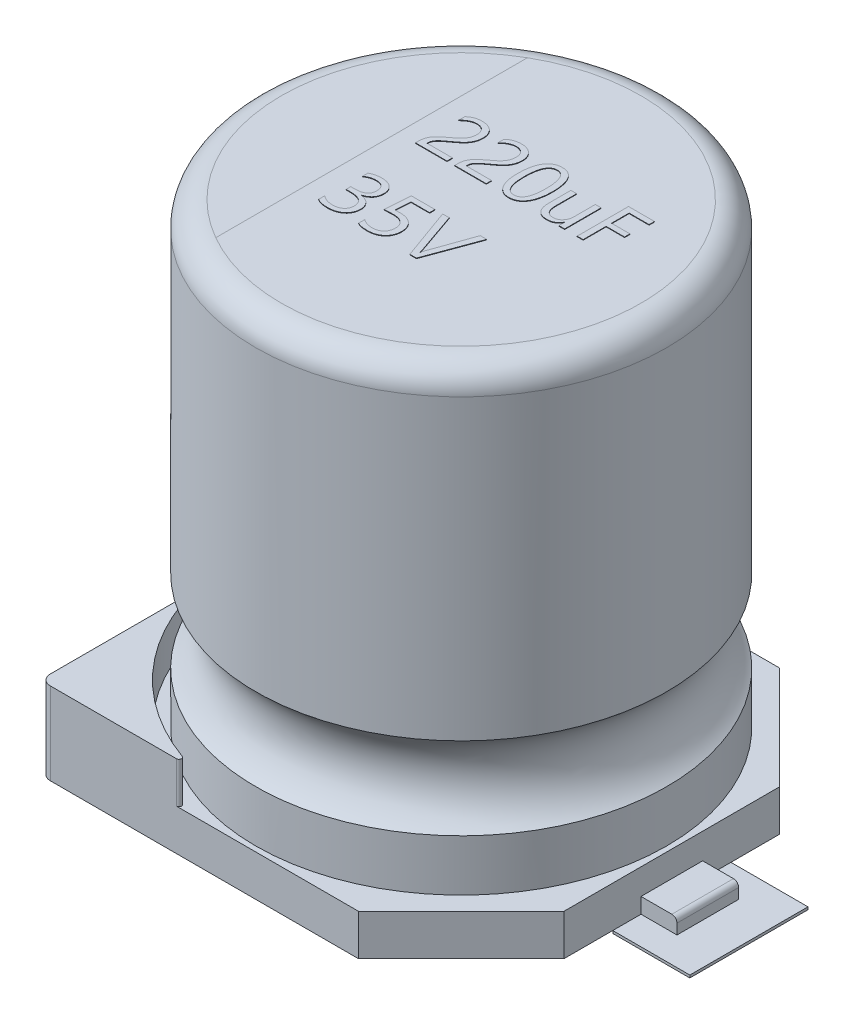
from build123d import *

# Parameters (mm, degrees)
SKETCH1_R             = 4
BOSS_EXTRUDE1_DEPTH   = 8.9
FILLET1_R             = 0.5
SKETCH3_W             = 8.2
SKETCH3_H             = 8.2
BOSS_EXTRUDE2_DEPTH   = 0.8
CHAMFER1_SIZE         = 2
BOSS_EXTRUDE3_DEPTH   = 0.8
FILLET2_R             = 0.05
SKETCH5_W             = 1.2
SKETCH5_H             = 0.3
BOSS_EXTRUDE4_DEPTH   = 0.7
FILLET3_R             = 0.1
FILLET4_R             = 0.2
BOSS_EXTRUDE5_DEPTH   = 0.01
SKETCH8_W             = 1.5
SKETCH8_H             = 2.3
BOSS_EXTRUDE6_DEPTH   = 0.05
BOSS_EXTRUDE6_2_DEPTH = 0.05


with BuildPart() as part:
    # Sketch1 → Boss-Extrude1 (new body)
    with BuildSketch(Plane(origin=(0, 0, 0), x_dir=(1, 0, 0), z_dir=(0, 1, 0))):
        with Locations(Location((0, 0, 0), (0, 0, 270))):
            Circle(SKETCH1_R)
    extrude(amount=BOSS_EXTRUDE1_DEPTH)

    # Sketch2 → Cut-Revolve1 (revolve, cut)
    with BuildSketch(Plane.XY, mode=Mode.PRIVATE) as cut_revolve1_sk:
        with BuildLine():
            Line((-4, 2.6), (-4, 1))
            ThreePointArc((-4, 1), (-3.6, 1.8), (-4, 2.6))
        make_face()
    revolve(cut_revolve1_sk.sketch.rotate(Axis((0, 0, 0), (0, 1, 0)), 270), axis=Axis((0, 0, 0), (0, 1, 0)), mode=Mode.SUBTRACT)

    # Fillet1
    fillet1_edges = [part.edges().sort_by_distance(p)[0] for p in [
        (0, 8.9, -4),
    ]]
    fillet(fillet1_edges, radius=FILLET1_R)

    # Sketch7 → Boss-Extrude5 (add)
    # profile 1 of 8: a face of its own
    with BuildSketch(Plane(origin=(0, 8.9, 0), x_dir=(1, 0, 0), z_dir=(0, 1, 0))):
        with BuildLine():
            add(Edge.make_bspline(
                [(-0.930125802, 1.236413932), (-0.930259114, 1.243960657), (-0.93051816, 1.258625219), (-0.933217585, 1.279837795), (-0.937690446, 1.299566075), (-0.94413612, 1.317704314), (-0.951973463, 1.334404835), (-0.960965693, 1.349697986), (-0.971418987, 1.363460373), (-0.983054115, 1.375758821), (-0.996025952, 1.386549119), (-1.009932817, 1.396056003), (-1.025099003, 1.403860125), (-1.041211775, 1.410259329), (-1.058234602, 1.415152609), (-1.075995938, 1.418551202), (-1.094393633, 1.421022673), (-1.106926382, 1.42116749), (-1.113308368, 1.421241235)],
                knots=[0, 0, 0, 0, 1.229976224, 2.390051507, 3.479695195, 4.522256188, 5.522020781, 6.484042306, 7.409278233, 8.334041706, 9.238256106, 10.155631384, 11.07524972, 12.01315198, 12.978606878, 13.958184871, 14.960257312, 16, 16, 16, 16], degree=3))
            add(Edge.make_bspline(
                [(-1.113308368, 1.421241235), (-1.124306368, 1.420793323), (-1.146359305, 1.419895181), (-1.178872583, 1.413005858), (-1.210521013, 1.40241095), (-1.241171261, 1.388330314), (-1.270914684, 1.371112065), (-1.299540216, 1.351126167), (-1.326558952, 1.328232214), (-1.343084419, 1.311316023), (-1.351384026, 1.302820182)],
                knots=[0, 0, 0, 0, 0.965628522, 1.936256016, 2.907294264, 3.893428475, 4.89415936, 5.923092914, 6.956912204, 8, 8, 8, 8], degree=3))
            Line((-1.351384026, 1.302820182), (-1.351384026, 1.42083005))
            add(Edge.make_bspline(
                [(-1.351384026, 1.42083005), (-1.343296156, 1.428056334), (-1.327247541, 1.442395319), (-1.300949265, 1.460807107), (-1.273441566, 1.476863251), (-1.244116711, 1.490122212), (-1.212383716, 1.500911096), (-1.177569131, 1.507976142), (-1.139616176, 1.512689044), (-1.11325576, 1.513121421), (-1.099533697, 1.513346498)],
                knots=[0, 0, 0, 0, 0.944214214, 1.873587351, 2.791167331, 3.715694743, 4.672957526, 5.704638579, 6.805136737, 8, 8, 8, 8], degree=3))
            add(Edge.make_bspline(
                [(-1.099533697, 1.513346498), (-1.089518573, 1.513173106), (-1.069843055, 1.512832463), (-1.040894307, 1.509428442), (-1.013088783, 1.50395329), (-0.986554824, 1.496101614), (-0.961388457, 1.486300469), (-0.937913947, 1.474271219), (-0.915882319, 1.460578007), (-0.895977467, 1.444386562), (-0.877700025, 1.426484826), (-0.861591307, 1.406379899), (-0.847568662, 1.384232224), (-0.835639917, 1.360212472), (-0.826140454, 1.334227892), (-0.819073757, 1.306500097), (-0.815276422, 1.276814851), (-0.814682385, 1.256503336), (-0.814377447, 1.246076761)],
                knots=[0, 0, 0, 0, 1.090983638, 2.143325233, 3.171486627, 4.175802002, 5.154894058, 6.110112073, 7.046608623, 7.976171165, 8.900318033, 9.829880575, 10.776682924, 11.751922351, 12.746640181, 13.786318399, 14.863643788, 16, 16, 16, 16], degree=3))
            add(Edge.make_bspline(
                [(-0.814377447, 1.246076761), (-0.814531458, 1.236477477), (-0.814832315, 1.217725566), (-0.817296719, 1.190235014), (-0.821581293, 1.1641952), (-0.827589826, 1.139459526), (-0.835290949, 1.115847829), (-0.84452299, 1.092916153), (-0.85568986, 1.07066016), (-0.86861869, 1.04908191), (-0.883474866, 1.028235552), (-0.899578239, 1.007520928), (-0.918102774, 0.987695275), (-0.938046494, 0.967928986), (-0.95974411, 0.948246214), (-0.983540843, 0.928904371), (-1.008684502, 0.908805781), (-1.026491879, 0.895947355), (-1.035594552, 0.889374458)],
                knots=[0, 0, 0, 0, 1.04820289, 2.047632774, 3.011021103, 3.927694667, 4.824695696, 5.721103316, 6.624792092, 7.54122121, 8.465198091, 9.418974354, 10.404208392, 11.42559055, 12.48532564, 13.601687869, 14.7740444, 16, 16, 16, 16], degree=3))
            add(Edge.make_bspline(
                [(-1.035594552, 0.889374458), (-1.0467608, 0.881350886), (-1.068090672, 0.866024183), (-1.098747881, 0.844129319), (-1.125870649, 0.823476711), (-1.150532456, 0.804966697), (-1.172179314, 0.787392622), (-1.191598763, 0.770750028), (-1.208272601, 0.754276876), (-1.22317442, 0.738674783), (-1.235595167, 0.723065216), (-1.246188175, 0.70768586), (-1.254710812, 0.692205633), (-1.261205012, 0.676468123), (-1.265985539, 0.660195794), (-1.26919072, 0.642970859), (-1.271348594, 0.624626665), (-1.271523986, 0.611968811), (-1.271614289, 0.605451761)],
                knots=[0, 0, 0, 0, 1.708614713, 3.263812021, 4.68081799, 5.944582465, 7.094984069, 8.145209792, 9.120763434, 10.006432465, 10.824334392, 11.596681272, 12.324558074, 13.015639001, 13.708135059, 14.427947188, 15.190609529, 16, 16, 16, 16], degree=3))
            Line((-1.271614289, 0.605451761), (-0.776137315, 0.605451761))
            Line((-0.776137315, 0.605451761), (-0.776137315, 0.500188603))
            Line((-0.776137315, 0.500188603), (-1.390240934, 0.500188603))
            Line((-1.390240934, 0.500188603), (-1.390240934, 0.549530708))
            add(Edge.make_bspline(
                [(-1.390240934, 0.549530708), (-1.390112493, 0.559885514), (-1.389862806, 0.580015245), (-1.387089622, 0.609264891), (-1.382867614, 0.636617894), (-1.376895913, 0.662301406), (-1.368836385, 0.68672351), (-1.358190542, 0.710143676), (-1.345652347, 0.73310337), (-1.330653103, 0.755473675), (-1.31330216, 0.777442221), (-1.293576524, 0.799395571), (-1.271447887, 0.821266274), (-1.246596291, 0.843251792), (-1.219042309, 0.865837507), (-1.188798854, 0.889960508), (-1.15557999, 0.915331717), (-1.132316114, 0.932513516), (-1.1202985, 0.941389261)],
                knots=[0, 0, 0, 0, 0.993935718, 1.932209879, 2.81819806, 3.64973488, 4.461244427, 5.283013065, 6.11642225, 6.970511397, 7.865615548, 8.802227002, 9.802589001, 10.85121407, 11.986896714, 13.223140369, 14.565534561, 16, 16, 16, 16], degree=3))
            add(Edge.make_bspline(
                [(-1.1202985, 0.941389261), (-1.111641587, 0.947800515), (-1.094865557, 0.960224736), (-1.070876025, 0.978759101), (-1.049583208, 0.997425348), (-1.030060537, 1.015265375), (-1.012617763, 1.033103702), (-0.99707653, 1.050910344), (-0.983161212, 1.068610325), (-0.967478787, 1.091941675), (-0.951391267, 1.121372266), (-0.938714616, 1.1585384), (-0.931274338, 1.196908293), (-0.930513309, 1.223085047), (-0.930125802, 1.236413932)],
                knots=[0, 0, 0, 0, 1.05745301, 2.049213797, 2.974384311, 3.835963594, 4.644633175, 5.421714405, 6.155056683, 6.852828246, 8.179982614, 9.432988448, 10.692908862, 12, 12, 12, 12], degree=3))
        make_face()
    # profile 2 of 8: a face of its own
    with BuildSketch(Plane(origin=(0, 8.9, 0), x_dir=(1, 0, 0), z_dir=(0, 1, 0))):
        with BuildLine():
            add(Edge.make_bspline(
                [(-0.166967907, 1.236413932), (-0.167101219, 1.243960657), (-0.167360266, 1.258625219), (-0.17005969, 1.279837795), (-0.174532551, 1.299566075), (-0.180978225, 1.317704314), (-0.188815569, 1.334404835), (-0.197807799, 1.349697986), (-0.208261093, 1.363460373), (-0.21989622, 1.375758821), (-0.232868057, 1.386549119), (-0.246774922, 1.396056003), (-0.261941108, 1.403860125), (-0.27805388, 1.410259329), (-0.295076707, 1.415152609), (-0.312838044, 1.418551202), (-0.331235738, 1.421022673), (-0.343768488, 1.42116749), (-0.350150473, 1.421241235)],
                knots=[0, 0, 0, 0, 1.229976224, 2.390051507, 3.479695195, 4.522256188, 5.522020781, 6.484042306, 7.409278233, 8.334041706, 9.238256106, 10.155631384, 11.07524972, 12.01315198, 12.978606878, 13.958184871, 14.960257312, 16, 16, 16, 16], degree=3))
            add(Edge.make_bspline(
                [(-0.350150473, 1.421241235), (-0.361148474, 1.420793323), (-0.38320141, 1.419895181), (-0.415714688, 1.413005858), (-0.447363119, 1.40241095), (-0.478013367, 1.388330314), (-0.507756789, 1.371112065), (-0.536382322, 1.351126167), (-0.563401057, 1.328232214), (-0.579926524, 1.311316023), (-0.588226131, 1.302820182)],
                knots=[0, 0, 0, 0, 0.965628522, 1.936256016, 2.907294264, 3.893428475, 4.89415936, 5.923092914, 6.956912204, 8, 8, 8, 8], degree=3))
            Line((-0.588226131, 1.302820182), (-0.588226131, 1.42083005))
            add(Edge.make_bspline(
                [(-0.588226131, 1.42083005), (-0.580138261, 1.428056334), (-0.564089646, 1.442395319), (-0.53779137, 1.460807107), (-0.510283672, 1.476863251), (-0.480958816, 1.490122212), (-0.449225821, 1.500911096), (-0.414411236, 1.507976142), (-0.376458281, 1.512689044), (-0.350097865, 1.513121421), (-0.336375802, 1.513346498)],
                knots=[0, 0, 0, 0, 0.944214214, 1.873587351, 2.791167331, 3.715694743, 4.672957526, 5.704638579, 6.805136737, 8, 8, 8, 8], degree=3))
            add(Edge.make_bspline(
                [(-0.336375802, 1.513346498), (-0.326360678, 1.513173106), (-0.30668516, 1.512832463), (-0.277736412, 1.509428442), (-0.249930889, 1.50395329), (-0.223396929, 1.496101614), (-0.198230563, 1.486300469), (-0.174756053, 1.474271219), (-0.152724424, 1.460578007), (-0.132819572, 1.444386562), (-0.11454213, 1.426484826), (-0.098433412, 1.406379899), (-0.084410767, 1.384232224), (-0.072482022, 1.360212472), (-0.062982559, 1.334227892), (-0.055915862, 1.306500097), (-0.052118527, 1.276814851), (-0.051524491, 1.256503336), (-0.051219552, 1.246076761)],
                knots=[0, 0, 0, 0, 1.090983638, 2.143325233, 3.171486627, 4.175802002, 5.154894058, 6.110112073, 7.046608623, 7.976171165, 8.900318033, 9.829880575, 10.776682924, 11.751922351, 12.746640181, 13.786318399, 14.863643788, 16, 16, 16, 16], degree=3))
            add(Edge.make_bspline(
                [(-0.051219552, 1.246076761), (-0.051373564, 1.236477477), (-0.05167442, 1.217725566), (-0.054138825, 1.190235014), (-0.058423399, 1.1641952), (-0.064431931, 1.139459526), (-0.072133054, 1.115847829), (-0.081365096, 1.092916153), (-0.092531965, 1.07066016), (-0.105460795, 1.04908191), (-0.120316971, 1.028235552), (-0.136420344, 1.007520928), (-0.154944879, 0.987695275), (-0.1748886, 0.967928986), (-0.196586215, 0.948246214), (-0.220382949, 0.928904371), (-0.245526608, 0.908805781), (-0.263333984, 0.895947355), (-0.272436657, 0.889374458)],
                knots=[0, 0, 0, 0, 1.04820289, 2.047632774, 3.011021103, 3.927694667, 4.824695696, 5.721103316, 6.624792092, 7.54122121, 8.465198091, 9.418974354, 10.404208392, 11.42559055, 12.48532564, 13.601687869, 14.7740444, 16, 16, 16, 16], degree=3))
            add(Edge.make_bspline(
                [(-0.272436657, 0.889374458), (-0.283602905, 0.881350886), (-0.304932777, 0.866024183), (-0.335589986, 0.844129319), (-0.362712754, 0.823476711), (-0.387374561, 0.804966697), (-0.409021419, 0.787392622), (-0.428440868, 0.770750028), (-0.445114706, 0.754276876), (-0.460016525, 0.738674783), (-0.472437273, 0.723065216), (-0.48303028, 0.70768586), (-0.491552917, 0.692205633), (-0.498047118, 0.676468123), (-0.502827644, 0.660195794), (-0.506032825, 0.642970859), (-0.508190699, 0.624626665), (-0.508366091, 0.611968811), (-0.508456394, 0.605451761)],
                knots=[0, 0, 0, 0, 1.708614713, 3.263812021, 4.68081799, 5.944582465, 7.094984069, 8.145209792, 9.120763434, 10.006432465, 10.824334392, 11.596681272, 12.324558074, 13.015639001, 13.708135059, 14.427947188, 15.190609529, 16, 16, 16, 16], degree=3))
            Line((-0.508456394, 0.605451761), (-0.012979421, 0.605451761))
            Line((-0.012979421, 0.605451761), (-0.012979421, 0.500188603))
            Line((-0.012979421, 0.500188603), (-0.627083039, 0.500188603))
            Line((-0.627083039, 0.500188603), (-0.627083039, 0.549530708))
            add(Edge.make_bspline(
                [(-0.627083039, 0.549530708), (-0.626954599, 0.559885514), (-0.626704911, 0.580015245), (-0.623931727, 0.609264891), (-0.619709719, 0.636617894), (-0.613738018, 0.662301406), (-0.60567849, 0.68672351), (-0.595032648, 0.710143676), (-0.582494452, 0.73310337), (-0.567495209, 0.755473675), (-0.550144265, 0.777442221), (-0.530418629, 0.799395571), (-0.508289992, 0.821266274), (-0.483438396, 0.843251792), (-0.455884415, 0.865837507), (-0.425640959, 0.889960508), (-0.392422095, 0.915331717), (-0.369158219, 0.932513516), (-0.357140605, 0.941389261)],
                knots=[0, 0, 0, 0, 0.993935718, 1.932209879, 2.81819806, 3.64973488, 4.461244427, 5.283013065, 6.11642225, 6.970511397, 7.865615548, 8.802227002, 9.802589001, 10.85121407, 11.986896714, 13.223140369, 14.565534561, 16, 16, 16, 16], degree=3))
            add(Edge.make_bspline(
                [(-0.357140605, 0.941389261), (-0.348483693, 0.947800515), (-0.331707662, 0.960224736), (-0.30771813, 0.978759101), (-0.286425314, 0.997425348), (-0.266902643, 1.015265375), (-0.249459869, 1.033103702), (-0.233918636, 1.050910344), (-0.220003318, 1.068610325), (-0.204320892, 1.091941675), (-0.188233373, 1.121372266), (-0.175556721, 1.1585384), (-0.168116443, 1.196908293), (-0.167355414, 1.223085047), (-0.166967907, 1.236413932)],
                knots=[0, 0, 0, 0, 1.05745301, 2.049213797, 2.974384311, 3.835963594, 4.644633175, 5.421714405, 6.155056683, 6.852828246, 8.179982614, 9.432988448, 10.692908862, 12, 12, 12, 12], degree=3))
        make_face()
    # profile 3 of 8: a face of its own
    with BuildSketch(Plane(origin=(0, 8.9, 0), x_dir=(1, 0, 0), z_dir=(0, 1, 0))):
        with BuildLine():
            add(Edge.make_bspline(
                [(0.768270579, 1.004711629), (0.767984026, 0.984557566), (0.767426863, 0.945370772), (0.763418175, 0.888304877), (0.756186625, 0.834774088), (0.746455105, 0.78474756), (0.733960132, 0.738431643), (0.718972384, 0.695758481), (0.701389132, 0.65682236), (0.681174329, 0.621736309), (0.658846167, 0.590281443), (0.633450707, 0.563262978), (0.606078237, 0.539685765), (0.575992083, 0.520517467), (0.54373231, 0.505217818), (0.50901846, 0.495007822), (0.472430214, 0.488007663), (0.447238608, 0.487360705), (0.434389, 0.487030708)],
                knots=[0, 0, 0, 0, 1.398980466, 2.720124312, 3.96812368, 5.146432578, 6.255415985, 7.295087503, 8.282879546, 9.216336252, 10.102253837, 10.953825877, 11.784043498, 12.603506409, 13.42284504, 14.253498671, 15.109153359, 16, 16, 16, 16], degree=3))
            add(Edge.make_bspline(
                [(0.434389, 0.487030708), (0.422230969, 0.487403858), (0.398436735, 0.488134142), (0.363754287, 0.494513325), (0.331026039, 0.504747043), (0.300408199, 0.519260787), (0.271987746, 0.537718507), (0.246029721, 0.560078852), (0.222359986, 0.586154425), (0.200953607, 0.615858168), (0.182100935, 0.649361911), (0.165598018, 0.686395783), (0.151799052, 0.727057537), (0.140003843, 0.771117384), (0.131133053, 0.818768253), (0.124605791, 0.869693802), (0.120647388, 0.923988105), (0.120245611, 0.961256343), (0.120038671, 0.980451761)],
                knots=[0, 0, 0, 0, 0.888155269, 1.738190458, 2.568434008, 3.38864091, 4.207101744, 5.03849325, 5.886044594, 6.7759361, 7.709272942, 8.69152049, 9.735599895, 10.845083744, 12.023162705, 13.27590253, 14.596923554, 16, 16, 16, 16], degree=3))
            add(Edge.make_bspline(
                [(0.120038671, 0.980451761), (0.120314337, 1.001497645), (0.120850059, 1.042397677), (0.124995631, 1.101825233), (0.131680111, 1.157428823), (0.141006661, 1.20925434), (0.153313788, 1.257126333), (0.168031411, 1.301093022), (0.18526661, 1.341086758), (0.205206931, 1.376997022), (0.227640682, 1.40900922), (0.252881939, 1.436746934), (0.280558491, 1.460461121), (0.31096194, 1.479788402), (0.343763603, 1.49483533), (0.37896513, 1.505504416), (0.416305751, 1.512337738), (0.442033999, 1.513005818), (0.455153803, 1.513346498)],
                knots=[0, 0, 0, 0, 1.426258677, 2.771754592, 4.035124818, 5.220331935, 6.337825632, 7.382114204, 8.359741748, 9.284994213, 10.161296122, 11.002979272, 11.820109764, 12.624106341, 13.436709906, 14.257961594, 15.111668944, 16, 16, 16, 16], degree=3))
            add(Edge.make_bspline(
                [(0.455153803, 1.513346498), (0.467789027, 1.512959369), (0.492452111, 1.512203721), (0.528206054, 1.506094994), (0.561617433, 1.496387059), (0.592397229, 1.482139609), (0.620789145, 1.464156343), (0.646779028, 1.442121729), (0.669979565, 1.415950319), (0.691035204, 1.3860259), (0.709055435, 1.351883719), (0.725299825, 1.31408476), (0.738401979, 1.272056949), (0.749543511, 1.226276634), (0.757771097, 1.176431001), (0.763905061, 1.12277945), (0.767619878, 1.065070853), (0.768048881, 1.025276442), (0.768270579, 1.004711629)],
                knots=[0, 0, 0, 0, 0.899241396, 1.755257189, 2.575108327, 3.369931066, 4.161902333, 4.96169813, 5.78762661, 6.645962214, 7.56082504, 8.531597655, 9.571777694, 10.691464586, 11.88443752, 13.166498411, 14.535713275, 16, 16, 16, 16], degree=3))
        make_face()
        with BuildLine():
            add(Edge.make_bspline(
                [(0.651699856, 0.993198471), (0.651522889, 1.010469562), (0.651180034, 1.043930687), (0.649093063, 1.092507874), (0.644804237, 1.137667761), (0.639767405, 1.179587018), (0.632455014, 1.218050581), (0.624029426, 1.253280964), (0.613704359, 1.285169971), (0.601960849, 1.313719893), (0.588489921, 1.338955551), (0.573519063, 1.360931968), (0.556847658, 1.379614653), (0.538509059, 1.394887973), (0.518583963, 1.406866101), (0.496880754, 1.414960968), (0.473790601, 1.420441518), (0.457791004, 1.42097051), (0.449602816, 1.421241235)],
                knots=[0, 0, 0, 0, 1.581181307, 3.063391078, 4.449305256, 5.73327765, 6.92683892, 8.031533681, 9.047337031, 9.992258722, 10.853979057, 11.661441156, 12.421081853, 13.138403699, 13.838846326, 14.537910874, 15.251739941, 16, 16, 16, 16], degree=3))
            add(Edge.make_bspline(
                [(0.449602816, 1.421241235), (0.441008756, 1.420956637), (0.424138756, 1.420397978), (0.39975072, 1.415083426), (0.376953282, 1.406638965), (0.35592608, 1.394518687), (0.336701034, 1.378867186), (0.319054913, 1.359920592), (0.303263696, 1.337502337), (0.289112272, 1.311820005), (0.276458182, 1.28281579), (0.26607136, 1.250213365), (0.256697728, 1.214429829), (0.249535481, 1.175157744), (0.243480639, 1.132653105), (0.239548982, 1.086666414), (0.23703384, 1.037292279), (0.236754015, 1.003207366), (0.236609395, 0.985591563)],
                knots=[0, 0, 0, 0, 0.764995805, 1.501674303, 2.212925961, 2.924256282, 3.65393935, 4.414460527, 5.224546987, 6.091227052, 7.023912083, 8.039810551, 9.137474513, 10.318540051, 11.595133009, 12.962565651, 14.430189818, 16, 16, 16, 16], degree=3))
            add(Edge.make_bspline(
                [(0.236609395, 0.985591563), (0.236755854, 0.969209241), (0.237039756, 0.937452912), (0.239543531, 0.891364271), (0.243523341, 0.848405362), (0.249348493, 0.808633363), (0.256283216, 0.771954437), (0.265416837, 0.738621381), (0.275777484, 0.708264032), (0.288118237, 0.681192385), (0.301765507, 0.656982181), (0.317577808, 0.636351776), (0.334643822, 0.618478865), (0.35379437, 0.604260881), (0.374382427, 0.592951387), (0.396618963, 0.58487104), (0.420546736, 0.580072872), (0.437039497, 0.579453407), (0.445490974, 0.579135971)],
                knots=[0, 0, 0, 0, 1.543513286, 2.992024866, 4.347767877, 5.607075833, 6.778486024, 7.862468221, 8.861099137, 9.797386861, 10.662401359, 11.473455982, 12.240599663, 12.983190345, 13.711379138, 14.446775782, 15.204072658, 16, 16, 16, 16], degree=3))
            add(Edge.make_bspline(
                [(0.445490974, 0.579135971), (0.453803181, 0.579462603), (0.470087117, 0.580102486), (0.493797116, 0.584815964), (0.515775862, 0.593201099), (0.536230147, 0.604593384), (0.554849281, 0.619420262), (0.571839842, 0.637397511), (0.587421335, 0.658496883), (0.600698358, 0.683184252), (0.61303245, 0.710733256), (0.623309355, 0.741627939), (0.632165265, 0.77569519), (0.639188306, 0.813015594), (0.645031646, 0.85347046), (0.648698582, 0.897202574), (0.651291767, 0.944099177), (0.651560842, 0.976472965), (0.651699856, 0.993198471)],
                knots=[0, 0, 0, 0, 0.775360401, 1.518961016, 2.243373551, 2.96192122, 3.694889719, 4.454670758, 5.264184671, 6.134259122, 7.064577354, 8.077594077, 9.167837551, 10.346585987, 11.618858978, 12.979815247, 14.439659868, 16, 16, 16, 16], degree=3))
        make_face(mode=Mode.SUBTRACT)
    # profile 4 of 8: a face of its own
    with BuildSketch(Plane(origin=(0, 8.9, 0), x_dir=(1, 0, 0), z_dir=(0, 1, 0))):
        with BuildLine():
            Line((1.513336369, 0.500188603), (1.399438343, 0.500188603))
            Line((1.399438343, 0.500188603), (1.399438343, 0.612441892))
            Line((1.399438343, 0.612441892), (1.396765645, 0.612441892))
            add(Edge.make_bspline(
                [(1.396765645, 0.612441892), (1.390720663, 0.602460299), (1.378922171, 0.5829784), (1.357224617, 0.557406109), (1.333497285, 0.535340747), (1.30679844, 0.517874984), (1.27796377, 0.503876254), (1.246605155, 0.493991312), (1.212766798, 0.488233325), (1.189414343, 0.487439271), (1.177398869, 0.487030708)],
                knots=[0, 0, 0, 0, 1.050691007, 2.050720406, 3.012962404, 3.962401766, 4.915874185, 5.894932476, 6.916885468, 8, 8, 8, 8], degree=3))
            add(Edge.make_bspline(
                [(1.177398869, 0.487030708), (1.167106673, 0.487257871), (1.147213655, 0.487696936), (1.11834269, 0.491353296), (1.091359331, 0.496789144), (1.066537263, 0.505487129), (1.043447569, 0.515877394), (1.022427463, 0.528850187), (1.003437756, 0.544280218), (0.986572548, 0.56212546), (0.971356904, 0.582119485), (0.958722421, 0.604808693), (0.947754222, 0.629646774), (0.938794621, 0.656780083), (0.931760999, 0.68627913), (0.926955997, 0.718120739), (0.92409119, 0.75232886), (0.923696159, 0.775881872), (0.923492619, 0.78801755)],
                knots=[0, 0, 0, 0, 1.09540131, 2.117219514, 3.094696566, 4.020015321, 4.911365501, 5.786165053, 6.642013186, 7.509079247, 8.394916856, 9.30993597, 10.267157936, 11.282441873, 12.347880503, 13.49236844, 14.707944063, 16, 16, 16, 16], degree=3))
            Line((0.923492619, 0.78801755), (0.923492619, 1.210714919))
            Line((0.923492619, 1.210714919), (1.036568277, 1.210714919))
            Line((1.036568277, 1.210714919), (1.036568277, 0.804053735))
            add(Edge.make_bspline(
                [(1.036568277, 0.804053735), (1.036658129, 0.79500285), (1.03683264, 0.777424219), (1.038994686, 0.751898193), (1.042143232, 0.72804247), (1.046826816, 0.705955212), (1.053044542, 0.68569587), (1.060388214, 0.66715835), (1.068975395, 0.650310847), (1.079241694, 0.635355566), (1.090611126, 0.621958112), (1.103608072, 0.610479502), (1.117877537, 0.600820717), (1.133413594, 0.592673278), (1.150370126, 0.586537416), (1.168663857, 0.582288295), (1.188210634, 0.579518344), (1.201717402, 0.57926565), (1.208648869, 0.579135971)],
                knots=[0, 0, 0, 0, 1.343703186, 2.609740898, 3.801442941, 4.915248641, 5.95827345, 6.944754588, 7.873313373, 8.759642607, 9.632786239, 10.476245362, 11.325882859, 12.18618061, 13.074785555, 13.995503533, 14.971323121, 16, 16, 16, 16], degree=3))
            add(Edge.make_bspline(
                [(1.208648869, 0.579135971), (1.215444264, 0.579340895), (1.228822529, 0.579744332), (1.248382544, 0.582703586), (1.267049545, 0.587339775), (1.284654366, 0.594262065), (1.301392063, 0.602948489), (1.317350699, 0.613434023), (1.332147143, 0.626102121), (1.345940795, 0.640486012), (1.358314303, 0.656498858), (1.369603949, 0.673539607), (1.378805849, 0.692024015), (1.38648315, 0.711539654), (1.39212846, 0.732324927), (1.396555207, 0.754141181), (1.398974255, 0.77727204), (1.39928124, 0.793083669), (1.399438343, 0.801175445)],
                knots=[0, 0, 0, 0, 0.99348202, 1.955893163, 2.886897847, 3.800751478, 4.715209456, 5.640858053, 6.586634716, 7.557773505, 8.550193329, 9.542613152, 10.542143211, 11.563936364, 12.604722674, 13.687744657, 14.816677783, 16, 16, 16, 16], degree=3))
            Line((1.399438343, 0.801175445), (1.399438343, 1.210714919))
            Line((1.399438343, 1.210714919), (1.513336369, 1.210714919))
            Line((1.513336369, 1.210714919), (1.513336369, 0.500188603))
        make_face()
    # profile 5 of 8: a face of its own
    with BuildSketch(Plane(origin=(0, 8.9, 0), x_dir=(1, 0, 0), z_dir=(0, 1, 0))):
        Polygon((2.261897224, 1.394925445), (1.873328145, 1.394925445), (1.873328145, 1.052820182), (2.232703145, 1.052820182), (2.232703145, 0.947557024), (1.873328145, 0.947557024), (1.873328145, 0.500188603), (1.756757421, 0.500188603), (1.756757421, 1.500188603), (2.261897224, 1.500188603), align=None)
    # profile 6 of 8: a face of its own
    with BuildSketch(Plane(origin=(0, 8.9, 0), x_dir=(1, 0, 0), z_dir=(0, 1, 0))):
        with BuildLine():
            add(Edge.make_bspline(
                [(-0.804714618, -1.148129406), (-0.805031256, -1.159112704), (-0.8056537, -1.180703538), (-0.810545623, -1.212322365), (-0.81821854, -1.242521604), (-0.829485239, -1.270996221), (-0.843387288, -1.297682296), (-0.860079885, -1.322502116), (-0.879355425, -1.34528654), (-0.901348015, -1.36596671), (-0.925648549, -1.384414873), (-0.952206937, -1.40091553), (-0.981289155, -1.41466786), (-1.012355786, -1.426716232), (-1.04546405, -1.436091712), (-1.080316635, -1.442913456), (-1.116853492, -1.446775249), (-1.141739816, -1.447372584), (-1.154426789, -1.447677104)],
                knots=[0, 0, 0, 0, 1.019101285, 2.003336971, 2.96304981, 3.905745115, 4.839035233, 5.7512084, 6.676507669, 7.603532857, 8.547600853, 9.50446321, 10.500287074, 11.529287479, 12.594462435, 13.68984929, 14.822292144, 16, 16, 16, 16], degree=3))
            add(Edge.make_bspline(
                [(-1.154426789, -1.447677104), (-1.165944596, -1.447526788), (-1.188459435, -1.447232953), (-1.221336029, -1.444725511), (-1.25237966, -1.440705925), (-1.281633165, -1.434909093), (-1.309040274, -1.4275651), (-1.334761093, -1.418788037), (-1.35857901, -1.408099658), (-1.373314855, -1.399493208), (-1.380578105, -1.395251117)],
                knots=[0, 0, 0, 0, 1.175724286, 2.298288404, 3.363967618, 4.369719485, 5.340477689, 6.258710396, 7.141724009, 8, 8, 8, 8], degree=3))
            Line((-1.380578105, -1.395251117), (-1.380578105, -1.276624472))
            add(Edge.make_bspline(
                [(-1.380578105, -1.276624472), (-1.372113234, -1.282940122), (-1.355363809, -1.295436887), (-1.328682314, -1.311438333), (-1.301220419, -1.325144501), (-1.272730503, -1.336277689), (-1.24334211, -1.344879631), (-1.213092942, -1.351082153), (-1.181936645, -1.35488503), (-1.160810908, -1.355340909), (-1.150109355, -1.35557184)],
                knots=[0, 0, 0, 0, 1.020300071, 2.018866019, 3.00237846, 3.983992981, 4.971245873, 5.95856543, 6.965881301, 8, 8, 8, 8], degree=3))
            add(Edge.make_bspline(
                [(-1.150109355, -1.35557184), (-1.141675575, -1.355410944), (-1.12511342, -1.355094978), (-1.100885827, -1.352709018), (-1.07798391, -1.348242785), (-1.056277923, -1.342703383), (-1.036079887, -1.334907669), (-1.017141665, -1.326003007), (-0.999750075, -1.315404178), (-0.983836357, -1.303503071), (-0.969564045, -1.290051617), (-0.95698736, -1.275241922), (-0.94619398, -1.259007402), (-0.937164125, -1.241502035), (-0.929860842, -1.222799256), (-0.925060693, -1.202799784), (-0.921829579, -1.181814566), (-0.921469052, -1.167399238), (-0.921285342, -1.160053748)],
                knots=[0, 0, 0, 0, 1.193357867, 2.343501928, 3.438959172, 4.492721389, 5.508499269, 6.497400075, 7.450321688, 8.385111628, 9.304331213, 10.219398486, 11.128434492, 12.056561698, 13.002003861, 13.96156304, 14.961291981, 16, 16, 16, 16], degree=3))
            add(Edge.make_bspline(
                [(-0.921285342, -1.160053748), (-0.921452323, -1.152022907), (-0.921777803, -1.136369207), (-0.925179058, -1.1137093), (-0.930453269, -1.092500743), (-0.938055121, -1.072844694), (-0.948003418, -1.05483614), (-0.960076511, -1.038435383), (-0.974193271, -1.02348093), (-0.990538325, -1.010044392), (-1.009173514, -0.998365958), (-1.029907565, -0.988216965), (-1.052840822, -0.979913093), (-1.077856579, -0.972919607), (-1.105056449, -0.967378448), (-1.134461499, -0.963559604), (-1.165973689, -0.961326297), (-1.187660477, -0.961002062), (-1.198834684, -0.960834998)],
                knots=[0, 0, 0, 0, 0.990580855, 1.930838357, 2.821223158, 3.683604226, 4.524093985, 5.353097825, 6.190816286, 7.056179088, 7.957307443, 8.899275577, 9.900203706, 10.963355231, 12.103032959, 13.323269139, 14.620803362, 16, 16, 16, 16], degree=3))
            Line((-1.198834684, -0.960834998), (-1.281277118, -0.960834998))
            Line((-1.281277118, -0.960834998), (-1.281277118, -0.868729735))
            Line((-1.281277118, -0.868729735), (-1.202946526, -0.868729735))
            add(Edge.make_bspline(
                [(-1.202946526, -0.868729735), (-1.193007467, -0.868540155), (-1.173792977, -0.868173654), (-1.145891773, -0.866262661), (-1.119977347, -0.862427464), (-1.0958372, -0.857749578), (-1.073772669, -0.85100883), (-1.053424255, -0.843334983), (-1.035072614, -0.83388113), (-1.018743146, -0.8228767), (-1.004084717, -0.810708342), (-0.991571883, -0.796887751), (-0.980872113, -0.781651578), (-0.972281366, -0.764877929), (-0.965408434, -0.74669158), (-0.960818977, -0.727053228), (-0.957834636, -0.706060275), (-0.957458433, -0.691588816), (-0.95726396, -0.684108025)],
                knots=[0, 0, 0, 0, 1.361615543, 2.632316345, 3.827071242, 4.948204408, 5.996555552, 6.983205608, 7.923628678, 8.816616634, 9.675964955, 10.526501328, 11.362408219, 12.21888074, 13.10109775, 14.018614351, 14.97575406, 16, 16, 16, 16], degree=3))
            add(Edge.make_bspline(
                [(-0.95726396, -0.684108025), (-0.95745195, -0.677182738), (-0.95781575, -0.663780842), (-0.959752018, -0.644352256), (-0.963511473, -0.626333625), (-0.9686285, -0.609586717), (-0.975175194, -0.594110872), (-0.983215575, -0.580000661), (-0.992865472, -0.56726574), (-1.003850801, -0.555807254), (-1.016457943, -0.545758273), (-1.030517917, -0.537167528), (-1.045933022, -0.529751133), (-1.062837544, -0.523789767), (-1.081125224, -0.519049017), (-1.101022061, -0.515876849), (-1.122307578, -0.513739142), (-1.137014352, -0.513558989), (-1.144558368, -0.513466577)],
                knots=[0, 0, 0, 0, 1.144475627, 2.214802505, 3.220728203, 4.180545248, 5.103803117, 5.991379618, 6.856426605, 7.737261095, 8.607258638, 9.512214307, 10.4541674, 11.428302948, 12.469117141, 13.571076801, 14.754054657, 16, 16, 16, 16], degree=3))
            add(Edge.make_bspline(
                [(-1.144558368, -0.513466577), (-1.153271214, -0.513660574), (-1.170614533, -0.514046732), (-1.196460904, -0.517276541), (-1.221912992, -0.522346096), (-1.246927429, -0.529619694), (-1.271475426, -0.538890374), (-1.295607949, -0.550337615), (-1.319498714, -0.563554497), (-1.334674891, -0.573987828), (-1.342337973, -0.579256051)],
                knots=[0, 0, 0, 0, 0.986643374, 1.963958899, 2.945918741, 3.923727424, 4.911347552, 5.914946884, 6.94716999, 8, 8, 8, 8], degree=3))
            Line((-1.342337973, -0.579256051), (-1.342337973, -0.475020854))
            add(Edge.make_bspline(
                [(-1.342337973, -0.475020854), (-1.334313811, -0.470712742), (-1.318143628, -0.462031095), (-1.292571059, -0.451268954), (-1.265941961, -0.441958124), (-1.238204929, -0.434317891), (-1.209243276, -0.428689844), (-1.179280012, -0.424273374), (-1.148094441, -0.421830319), (-1.126949941, -0.421519521), (-1.116186657, -0.421361314)],
                knots=[0, 0, 0, 0, 0.92965156, 1.873421247, 2.829591002, 3.809240957, 4.808444756, 5.840751768, 6.9008678, 8, 8, 8, 8], degree=3))
            add(Edge.make_bspline(
                [(-1.116186657, -0.421361314), (-1.10603432, -0.421533555), (-1.086085178, -0.421872005), (-1.057011528, -0.425261363), (-1.029331999, -0.430533872), (-1.003303978, -0.438196717), (-0.97876251, -0.447568336), (-0.956081226, -0.458933787), (-0.935194447, -0.471902725), (-0.916167806, -0.486560316), (-0.899075553, -0.502817061), (-0.883904639, -0.52061409), (-0.87088699, -0.540078482), (-0.860026398, -0.561049279), (-0.851296722, -0.583352405), (-0.845195716, -0.606886134), (-0.841359328, -0.631556179), (-0.840918137, -0.648389153), (-0.840693236, -0.656969867)],
                knots=[0, 0, 0, 0, 1.197034325, 2.352148888, 3.447599133, 4.516879017, 5.548177483, 6.54231138, 7.50454852, 8.443935387, 9.370188229, 10.282043863, 11.19676135, 12.125937188, 13.062642227, 14.015530744, 14.988404392, 16, 16, 16, 16], degree=3))
            add(Edge.make_bspline(
                [(-0.840693236, -0.656969867), (-0.840866106, -0.664923951), (-0.841205106, -0.680522009), (-0.843418775, -0.70335583), (-0.847388687, -0.72505397), (-0.852678003, -0.745714975), (-0.859618195, -0.765301715), (-0.868439713, -0.783701759), (-0.87833428, -0.801172273), (-0.890109896, -0.817388144), (-0.903180705, -0.832662693), (-0.918140027, -0.846604611), (-0.934445761, -0.859678035), (-0.952398977, -0.871524776), (-0.971771396, -0.882526463), (-0.992784165, -0.892120699), (-1.01536155, -0.900565727), (-1.031043549, -0.905341763), (-1.039089618, -0.907792235)],
                knots=[0, 0, 0, 0, 1.096960776, 2.151153854, 3.159618439, 4.136134396, 5.089743263, 6.019833047, 6.947085499, 7.854572729, 8.77922067, 9.715197914, 10.670163965, 11.658363707, 12.678233686, 13.739646337, 14.840265149, 16, 16, 16, 16], degree=3))
            Line((-1.039089618, -0.907792235), (-1.039089618, -0.910670525))
            add(Edge.make_bspline(
                [(-1.039089618, -0.910670525), (-1.030783191, -0.911806902), (-1.014419407, -0.914045583), (-0.990398194, -0.919043225), (-0.967569, -0.926484516), (-0.945531067, -0.934924636), (-0.924858448, -0.945294604), (-0.905323232, -0.956753399), (-0.887435698, -0.969938123), (-0.871089828, -0.984644676), (-0.856302948, -1.000686878), (-0.842983429, -1.017995709), (-0.831734606, -1.036845889), (-0.822010133, -1.056826634), (-0.814139848, -1.077997543), (-0.808600806, -1.100404754), (-0.805236443, -1.123903377), (-0.804890523, -1.139962925), (-0.804714618, -1.148129406)],
                knots=[0, 0, 0, 0, 1.09354583, 2.154301538, 3.194710689, 4.222252129, 5.229688408, 6.207785533, 7.17326046, 8.12275326, 9.071656757, 10.015663309, 10.966165492, 11.929693435, 12.91109378, 13.906239898, 14.935296686, 16, 16, 16, 16], degree=3))
        make_face()
    # profile 7 of 8: a face of its own
    with BuildSketch(Plane(origin=(0, 8.9, 0), x_dir=(1, 0, 0), z_dir=(0, 1, 0))):
        with BuildLine():
            add(Edge.make_bspline(
                [(-0.03045475, -1.127775788), (-0.030802403, -1.139574748), (-0.031484148, -1.162712395), (-0.035906733, -1.196669956), (-0.04406565, -1.228776685), (-0.054874076, -1.259148157), (-0.068806492, -1.287475253), (-0.085215565, -1.313832799), (-0.104354349, -1.338196132), (-0.126176369, -1.360347166), (-0.150424426, -1.380386349), (-0.177374985, -1.397725884), (-0.206473587, -1.413005561), (-0.238108655, -1.425393112), (-0.271594661, -1.435646199), (-0.307107851, -1.44238049), (-0.344344432, -1.4469306), (-0.36980431, -1.447424321), (-0.382839618, -1.447677104)],
                knots=[0, 0, 0, 0, 1.056864167, 2.072500419, 3.059485391, 4.018613275, 4.954681828, 5.881162702, 6.794724112, 7.723560484, 8.661137091, 9.605998599, 10.588833302, 11.59982216, 12.644532083, 13.720683555, 14.833003331, 16, 16, 16, 16], degree=3))
            add(Edge.make_bspline(
                [(-0.382839618, -1.447677104), (-0.394011781, -1.44755688), (-0.415687047, -1.447323631), (-0.44705982, -1.445589255), (-0.476188121, -1.442162006), (-0.503154717, -1.438066715), (-0.52787873, -1.432285861), (-0.550359407, -1.425324282), (-0.570695721, -1.417259251), (-0.582942468, -1.410454138), (-0.588842907, -1.407175459)],
                knots=[0, 0, 0, 0, 1.263126396, 2.450608766, 3.550077914, 4.578015321, 5.532741343, 6.41739748, 7.237507678, 8, 8, 8, 8], degree=3))
            Line((-0.588842907, -1.407175459), (-0.588842907, -1.289782367))
            add(Edge.make_bspline(
                [(-0.588842907, -1.289782367), (-0.580486624, -1.295047632), (-0.563958074, -1.305462213), (-0.538240806, -1.318689721), (-0.512514242, -1.330073303), (-0.486640452, -1.339444348), (-0.46057513, -1.346605094), (-0.434330806, -1.351776104), (-0.407933099, -1.354979568), (-0.39024973, -1.355374304), (-0.381400473, -1.35557184)],
                knots=[0, 0, 0, 0, 1.073575538, 2.123509434, 3.141212585, 4.131255582, 5.1129617, 6.077547705, 7.037950563, 8, 8, 8, 8], degree=3))
            add(Edge.make_bspline(
                [(-0.381400473, -1.35557184), (-0.372617836, -1.355388981), (-0.355407639, -1.355030654), (-0.330324015, -1.351802344), (-0.306442828, -1.347029456), (-0.284039183, -1.339744061), (-0.263136581, -1.330749682), (-0.243776786, -1.320167604), (-0.22602342, -1.308039635), (-0.209871884, -1.29419492), (-0.19549013, -1.278678747), (-0.182606955, -1.261858724), (-0.171937685, -1.243311522), (-0.162893185, -1.223573267), (-0.155556814, -1.20255171), (-0.150878043, -1.180358364), (-0.147550102, -1.157275006), (-0.147202924, -1.141563111), (-0.147025473, -1.133532367)],
                knots=[0, 0, 0, 0, 1.158660806, 2.270477318, 3.333079092, 4.368579658, 5.373363954, 6.332745853, 7.27608927, 8.206156569, 9.134110276, 10.063957633, 10.99630925, 11.951503368, 12.926911662, 13.927616427, 14.940752784, 16, 16, 16, 16], degree=3))
            add(Edge.make_bspline(
                [(-0.147025473, -1.133532367), (-0.147214801, -1.125504516), (-0.147585215, -1.109798279), (-0.150720263, -1.086857782), (-0.15588238, -1.065263813), (-0.162741731, -1.044864207), (-0.172226903, -1.026114831), (-0.183233505, -1.008384945), (-0.196845966, -0.992409341), (-0.212000946, -0.977427808), (-0.229393724, -0.964366436), (-0.248489767, -0.952710772), (-0.269472669, -0.942803068), (-0.292445879, -0.9351487), (-0.317112227, -0.928920598), (-0.343575951, -0.924473626), (-0.371954044, -0.921743454), (-0.391468002, -0.921491479), (-0.4015485, -0.921361314)],
                knots=[0, 0, 0, 0, 1.024220939, 2.003855773, 2.947861307, 3.855091956, 4.742976808, 5.623725423, 6.511739495, 7.414744547, 8.338353125, 9.280330718, 10.266270024, 11.292393647, 12.365736532, 13.510265708, 14.713855882, 16, 16, 16, 16], degree=3))
            add(Edge.make_bspline(
                [(-0.4015485, -0.921361314), (-0.408402298, -0.921394443), (-0.422523667, -0.921462702), (-0.444035494, -0.922254008), (-0.466114501, -0.922665261), (-0.488237145, -0.923887785), (-0.510116155, -0.924724478), (-0.531286091, -0.926244892), (-0.551239012, -0.92779629), (-0.564037249, -0.929147098), (-0.570134026, -0.92979059)],
                knots=[0, 0, 0, 0, 0.974070636, 2.006947305, 3.059296761, 4.112367188, 5.155707916, 6.170982707, 7.128699404, 8, 8, 8, 8], degree=3))
            Line((-0.570134026, -0.92979059), (-0.536211329, -0.434519209))
            Line((-0.536211329, -0.434519209), (-0.076096197, -0.434519209))
            Line((-0.076096197, -0.434519209), (-0.076096197, -0.539782367))
            Line((-0.076096197, -0.539782367), (-0.43773271, -0.539782367))
            Line((-0.43773271, -0.539782367), (-0.457880736, -0.832751117))
            add(Edge.make_bspline(
                [(-0.457880736, -0.832751117), (-0.450275909, -0.832230981), (-0.434595457, -0.831158508), (-0.411007154, -0.830322134), (-0.388055393, -0.829335855), (-0.373177766, -0.829281563), (-0.366186657, -0.829256051)],
                knots=[0, 0, 0, 0, 0.996597619, 2.054892104, 3.085979286, 4, 4, 4, 4], degree=3))
            add(Edge.make_bspline(
                [(-0.366186657, -0.829256051), (-0.35336202, -0.829471408), (-0.328266942, -0.829892817), (-0.291741562, -0.83379702), (-0.257320497, -0.840447124), (-0.224999115, -0.849354217), (-0.194948011, -0.860993658), (-0.166947403, -0.874409082), (-0.141616814, -0.890581171), (-0.118623148, -0.908719161), (-0.098098632, -0.929021564), (-0.080036561, -0.95146848), (-0.065079069, -0.976424175), (-0.052466909, -1.003198072), (-0.042668496, -1.031899989), (-0.035348753, -1.0622926), (-0.031314442, -1.094497952), (-0.03074537, -1.116526179), (-0.03045475, -1.127775788)],
                knots=[0, 0, 0, 0, 1.209722839, 2.367169476, 3.460249484, 4.51448871, 5.52555128, 6.497162283, 7.438882481, 8.354766373, 9.255461188, 10.15719975, 11.065382765, 11.993869493, 12.944690782, 13.921729643, 14.938646801, 16, 16, 16, 16], degree=3))
        make_face()
    # profile 8 of 8: a face of its own
    with BuildSketch(Plane(origin=(0, 8.9, 0), x_dir=(1, 0, 0), z_dir=(0, 1, 0))):
        with BuildLine():
            Line((0.93048275, -0.434519209), (0.562061698, -1.434519209))
            Line((0.562061698, -1.434519209), (0.433772224, -1.434519209))
            Line((0.433772224, -1.434519209), (0.072958079, -0.434519209))
            Line((0.072958079, -0.434519209), (0.202686698, -0.434519209))
            Line((0.202686698, -0.434519209), (0.478180119, -1.227282367))
            add(Edge.make_bspline(
                [(0.478180119, -1.227282367), (0.480292487, -1.233912657), (0.48464027, -1.247559459), (0.490253492, -1.26899756), (0.494618629, -1.291975053), (0.497072805, -1.307798624), (0.498328145, -1.315892564)],
                knots=[0, 0, 0, 0, 0.917522195, 1.888491001, 2.919938635, 4, 4, 4, 4], degree=3))
            Line((0.498328145, -1.315892564), (0.501000843, -1.315892564))
            add(Edge.make_bspline(
                [(0.501000843, -1.315892564), (0.502053286, -1.308743424), (0.504203131, -1.294139758), (0.509683649, -1.272075225), (0.515798621, -1.249046887), (0.521244423, -1.233690261), (0.524027158, -1.225843222)],
                knots=[0, 0, 0, 0, 0.930702889, 1.901162278, 2.927520758, 4, 4, 4, 4], degree=3))
            Line((0.524027158, -1.225843222), (0.804865974, -0.434519209))
            Line((0.804865974, -0.434519209), (0.93048275, -0.434519209))
        make_face()
    extrude(amount=BOSS_EXTRUDE5_DEPTH)


with BuildPart() as body_2:
    # Sketch3 → Boss-Extrude2 (new body)
    with BuildSketch(Plane.XZ):
        Rectangle(SKETCH3_W, SKETCH3_H)
    extrude(amount=BOSS_EXTRUDE2_DEPTH)

    # Chamfer1
    chamfer1_edges = [body_2.edges().sort_by_distance(p)[0] for p in [
        (4.1, -0.4, 4.1),
        (4.1, -0.4, -4.1),
    ]]
    chamfer(chamfer1_edges, length=CHAMFER1_SIZE)

    # Sketch4 → Boss-Extrude3 (add)
    with BuildSketch(Plane(origin=(0, 0, 0), x_dir=(1, 0, 0), z_dir=(0, 1, 0))):
        with BuildLine():
            Line((-1.119151464, -4.1), (-4.1, -4.1))
            Line((-4.1, -4.1), (-4.1, -1.119151464))
            ThreePointArc((-4.1, -1.119151464), (-3.00520382, -3.00520382), (-1.119151464, -4.1))
        make_face()
        with BuildLine():
            Line((-4.1, 4.1), (-1.119151464, 4.1))
            ThreePointArc((-1.119151464, 4.1), (-3.00520382, 3.00520382), (-4.1, 1.119151464))
            Line((-4.1, 1.119151464), (-4.1, 4.1))
        make_face()
    extrude(amount=BOSS_EXTRUDE3_DEPTH)

    # Fillet2
    fillet2_edges = [body_2.edges().sort_by_distance(p)[0] for p in [
        (-4.1, 0.4, -1.119151464),
        (-1.119151464, 0.4, -4.1),
        (-4.1, 0.4, 1.119151464),
        (-1.119151464, 0.4, 4.1),
    ]]
    fillet(fillet2_edges, radius=FILLET2_R)

    # Fillet4
    fillet4_edges = [body_2.edges().sort_by_distance(p)[0] for p in [
        (-4.1, 0, 4.1),
        (-4.1, 0, -4.1),
    ]]
    fillet(fillet4_edges, radius=FILLET4_R)


with BuildPart() as body_3:
    # Sketch5 → Boss-Extrude4 (new body)
    with BuildSketch(Plane.ZY.offset(4.1)):
        with Locations((0, -0.65)):
            Rectangle(SKETCH5_W, SKETCH5_H)
    extrude(amount=BOSS_EXTRUDE4_DEPTH)

    # Fillet3
    fillet3_edges = [body_3.edges().sort_by_distance(p)[0] for p in [
        (-4.8, -0.5, 0),
    ]]
    fillet(fillet3_edges, radius=FILLET3_R)


with BuildPart() as body_4:
    # Mirror3: mirrored copy
    add(body_3.part.mirror(Plane(origin=(0, 0, 0), x_dir=(0, 0, 1), z_dir=(1, 0, 0))))


with BuildPart() as body_5:
    # Sketch8 → Boss-Extrude6 (new body)
    with BuildSketch(Plane.XZ.offset(0.8)):
        with Locations((-4.85, 0)):
            Rectangle(SKETCH8_W, SKETCH8_H)
    extrude(amount=BOSS_EXTRUDE6_DEPTH)


with BuildPart() as body_6:
    # Sketch8 → Boss-Extrude6 2 (new body)
    with BuildSketch(Plane.XZ.offset(0.8)):
        with Locations((4.85, 0)):
            Rectangle(SKETCH8_W, SKETCH8_H)
    extrude(amount=BOSS_EXTRUDE6_2_DEPTH)


solid = Compound([part.part, body_2.part, body_3.part, body_4.part, body_5.part, body_6.part])
